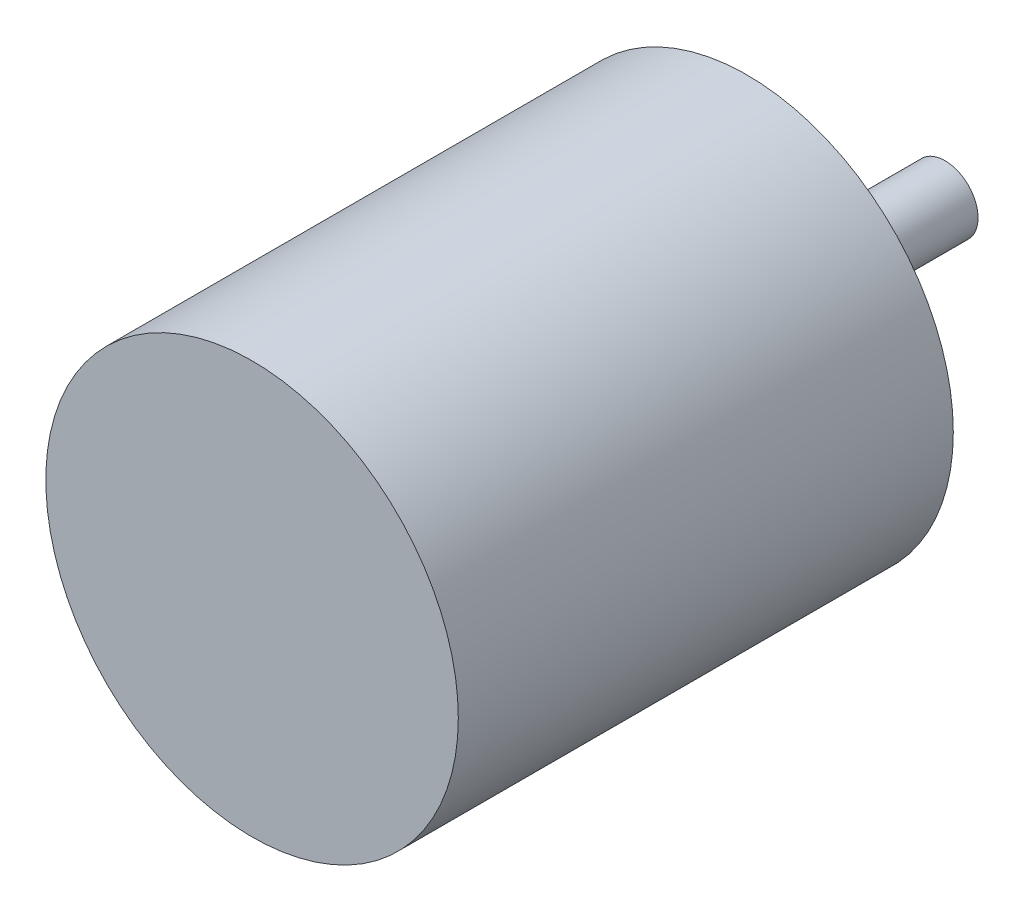
from build123d import *

# Parameters (mm, degrees)
SKETCH_1_R          = 12.5
EXTRUDE_3_DEPTH     = 30
SKETCH_3_R          = 1.5
CUT_EXTRUDE_1_DEPTH = 15
SKETCH_4_R          = 6
EXTRUDE_4_DEPTH     = 2
SKETCH_5_R          = 2
EXTRUDE_5_DEPTH     = 10


with BuildPart() as part:
    # 草图1 → 凸台-拉伸3 (new body)
    with BuildSketch(Plane.XY):
        Circle(SKETCH_1_R)
    extrude(amount=EXTRUDE_3_DEPTH)

    # 草图3 → 切除-拉伸1 (cut)
    with BuildSketch(Plane(origin=(0, 0, 0), x_dir=(-1, 0, 0), z_dir=(0, 0, -1))):
        with Locations((8.5, 0)):
            Circle(SKETCH_3_R)
        with Locations((-8.5, 0)):
            Circle(SKETCH_3_R)
    extrude(amount=-CUT_EXTRUDE_1_DEPTH, mode=Mode.SUBTRACT)

    # 草图4 → 凸台-拉伸4 (add)
    with BuildSketch(Plane(origin=(0, 0, 0), x_dir=(-1, 0, 0), z_dir=(0, 0, -1))):
        with Locations(Location((0, 0, 0), (0, 0, 180))):
            Circle(SKETCH_4_R)
    extrude(amount=EXTRUDE_4_DEPTH)

    # 草图5 → 凸台-拉伸5 (add)
    with BuildSketch(Plane(origin=(0, 0, -2), x_dir=(-1, 0, 0), z_dir=(0, 0, -1))):
        Circle(SKETCH_5_R)
    extrude(amount=EXTRUDE_5_DEPTH)


solid = part.part
